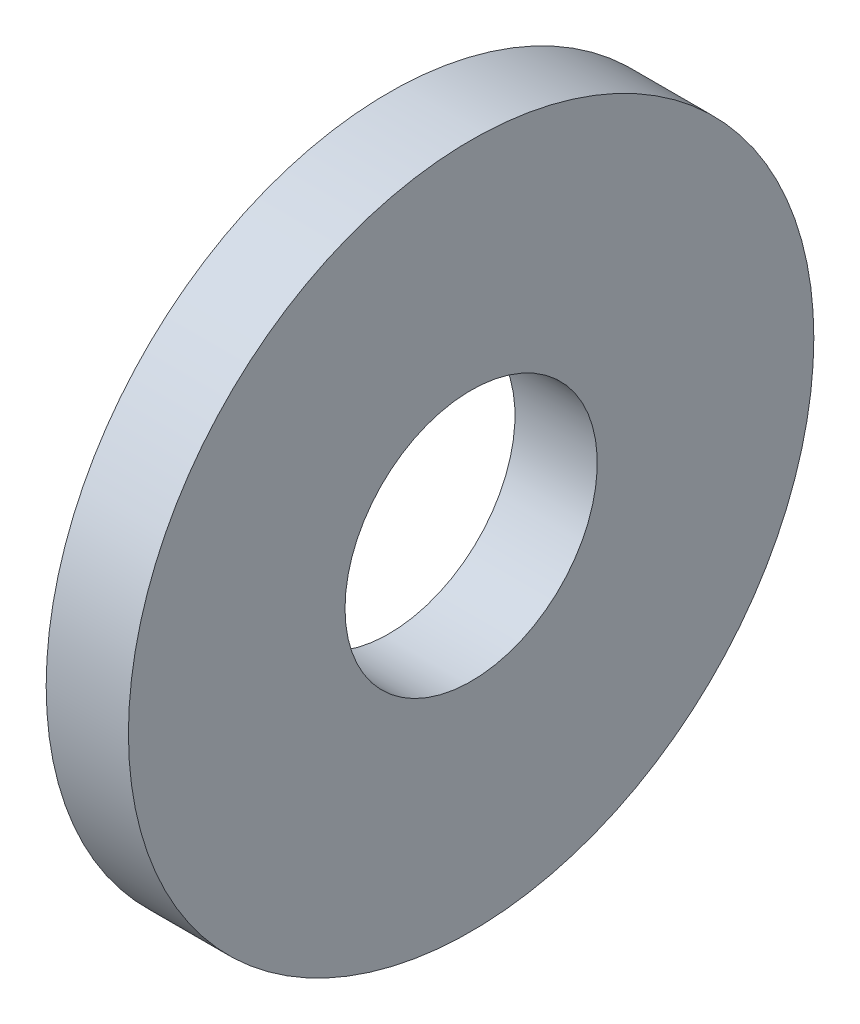
from build123d import *

# Parameters (mm, degrees)
SKETCH1_W = 1.2
SKETCH1_H = 3.16


with BuildPart() as part:
    # Sketch1 → Base-Revolve (revolve)
    with BuildSketch(Plane.XY, mode=Mode.PRIVATE) as base_revolve_sk:
        with Locations((-0.6, 3.42)):
            Rectangle(SKETCH1_W, SKETCH1_H)
    revolve(base_revolve_sk.sketch.rotate(Axis((-34.925, 0, 0), (1, 0, 0)), 90), axis=Axis((-34.925, 0, 0), (1, 0, 0)))


solid = part.part
